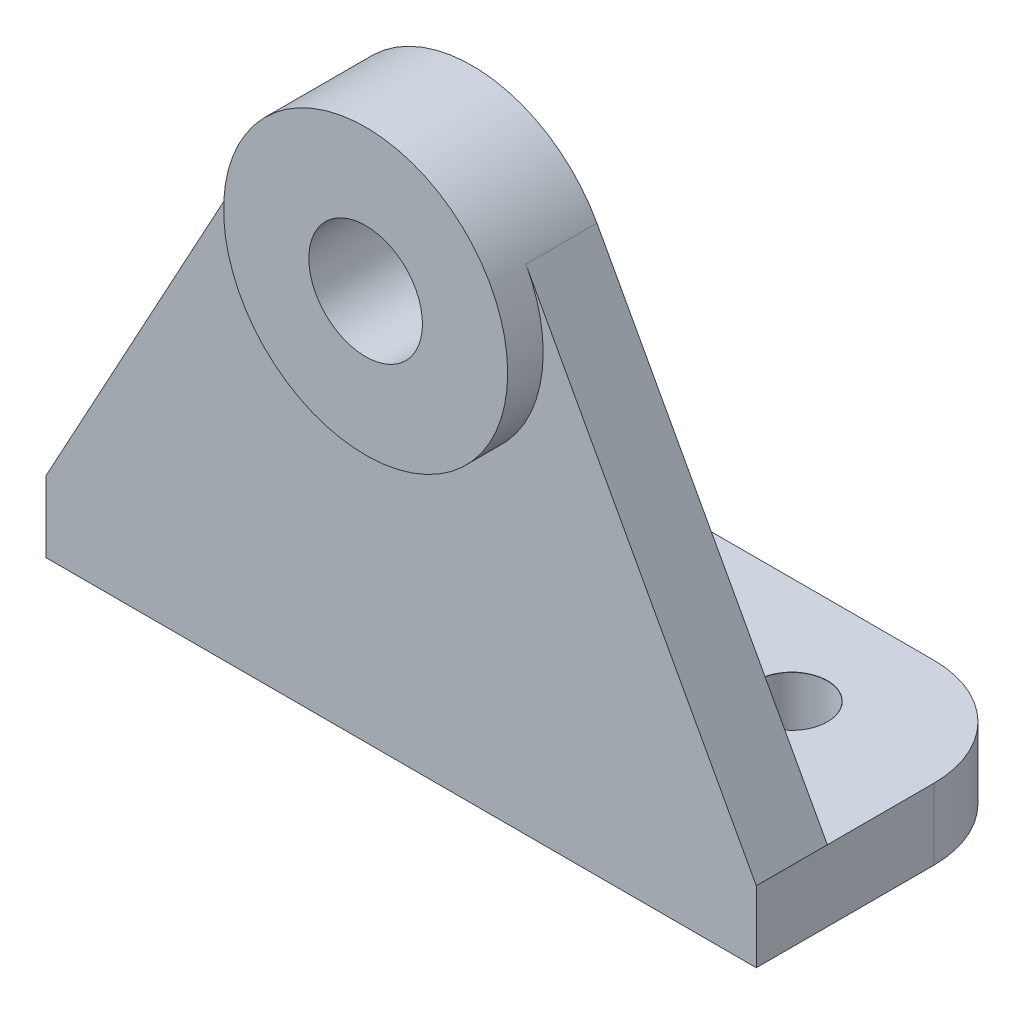
from build123d import *

# Parameters (mm, degrees)
CROQUIS1_W                           = 100
CROQUIS1_H                           = 40
SALIENTE_EXTRUIR1_DEPTH              = 10
CROQUIS2_R                           = 8
SALIENTE_EXTRUIR2_DEPTH              = 10
SALIENTE_EXTRUIR3_START              = 5
CROQUIS3_R                           = 20
CROQUIS3_R_2                         = 8
SALIENTE_EXTRUIR3_DEPTH              = 5
F_9_8_9_8_DIAMETER_HOLE1_D           = 9.8
F_9_8_9_8_DIAMETER_HOLE1_CSINK_D     = 9.85
F_9_8_9_8_DIAMETER_HOLE1_CSINK_ANGLE = 100
F_10_0_10_DIAMETER_HOLE1_D           = 10
F_10_0_10_DIAMETER_HOLE1_CSINK_D     = 10.05
F_10_0_10_DIAMETER_HOLE1_CSINK_ANGLE = 100
REDONDEO1_R                          = 15


with BuildPart() as part:
    # Croquis1 → Saliente-Extruir1 (new body)
    with BuildSketch(Plane(origin=(0, 0, 0), x_dir=(1, 0, 0), z_dir=(0, 1, 0))):
        Rectangle(CROQUIS1_W, CROQUIS1_H)
    extrude(amount=SALIENTE_EXTRUIR1_DEPTH)

    # Croquis2 → Saliente-Extruir2 (add)
    with BuildSketch(Plane.XY.offset(20)):
        with BuildLine():
            Line((-50, 10), (-17.564659966, 69.564659966))
            ThreePointArc((-17.564659966, 69.564659966), (0, 80), (17.564659966, 69.564659966))
            Line((17.564659966, 69.564659966), (50, 10))
            Line((50, 10), (-50, 10))
        make_face()
        with Locations((0, 60)):
            Circle(CROQUIS2_R, mode=Mode.SUBTRACT)
    extrude(amount=-SALIENTE_EXTRUIR2_DEPTH)

    # Croquis3 → Saliente-Extruir3 (add)
    with BuildSketch(Plane.XY.offset(20).offset(SALIENTE_EXTRUIR3_START)):
        with Locations((0, 60)):
            Circle(CROQUIS3_R)
        with Locations((0, 60)):
            Circle(CROQUIS3_R_2, mode=Mode.SUBTRACT)
    extrude(amount=-SALIENTE_EXTRUIR3_DEPTH)

    # Ø9.8 (9.8) Diameter Hole1 (through all)
    with Locations(Plane(origin=(0, 10, 0), x_dir=(1, 0, 0), z_dir=(0, 1, 0))):
        with Locations((-30, 5)):
            CounterSinkHole(F_9_8_9_8_DIAMETER_HOLE1_D / 2, F_9_8_9_8_DIAMETER_HOLE1_CSINK_D / 2, counter_sink_angle=F_9_8_9_8_DIAMETER_HOLE1_CSINK_ANGLE)

    # Ø10.0 (10) Diameter Hole1 (through all)
    with Locations(Plane(origin=(0, 10, 0), x_dir=(1, 0, 0), z_dir=(0, 1, 0))):
        with Locations((30, 5)):
            CounterSinkHole(F_10_0_10_DIAMETER_HOLE1_D / 2, F_10_0_10_DIAMETER_HOLE1_CSINK_D / 2, counter_sink_angle=F_10_0_10_DIAMETER_HOLE1_CSINK_ANGLE)

    # Redondeo1
    redondeo1_edges = [part.edges().sort_by_distance(p)[0] for p in [
        (-50, 5, -20),
        (50, 5, -20),
    ]]
    fillet(redondeo1_edges, radius=REDONDEO1_R)


solid = part.part
